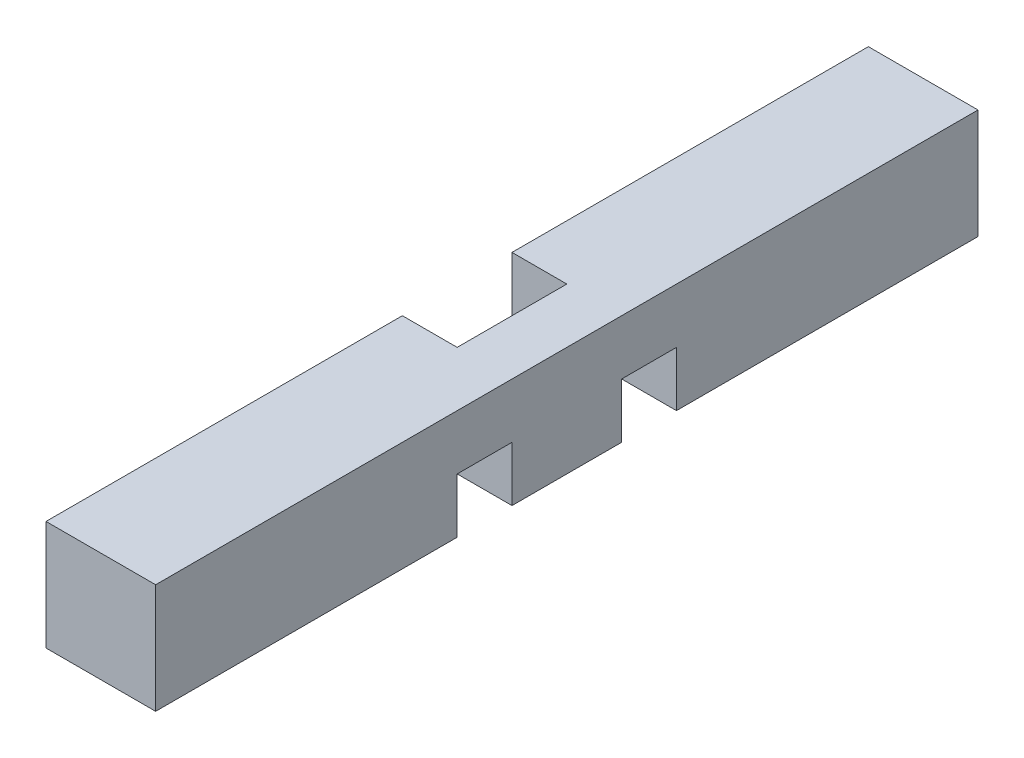
from build123d import *

# Parameters (mm, degrees)
SKETCH_1_W          = 4
SKETCH_1_H          = 4
EXTRUDE_1_DEPTH     = 30
SKETCH_3_W          = 8
SKETCH_3_H          = 2
CUT_EXTRUDE_1_DEPTH = 2
SKETCH_5_W          = 2
SKETCH_5_H          = 2
CUT_EXTRUDE_2_DEPTH = 2
SKETCH_6_W          = 2
SKETCH_6_H          = 2
CUT_EXTRUDE_3_DEPTH = 2
SKETCH_8_W          = 2
SKETCH_8_H          = 4
CUT_EXTRUDE_4_DEPTH = 2


with BuildPart() as part:
    # 草圖1 → 填料-伸長1 (new body)
    with BuildSketch(Plane.XY):
        Rectangle(SKETCH_1_W, SKETCH_1_H)
    extrude(amount=EXTRUDE_1_DEPTH)

    # 草圖3 → 除料-伸長1 (cut)
    with BuildSketch(Plane.ZY.offset(2)):
        with Locations((15, -1)):
            Rectangle(SKETCH_3_W, SKETCH_3_H)
    extrude(amount=-CUT_EXTRUDE_1_DEPTH, mode=Mode.SUBTRACT)

    # 草圖5 → 除料-伸長2 (cut)
    with BuildSketch(Plane.ZY):
        with Locations((18, -1)):
            Rectangle(SKETCH_5_W, SKETCH_5_H)
    extrude(amount=-CUT_EXTRUDE_2_DEPTH, mode=Mode.SUBTRACT)

    # 草圖6 → 除料-伸長3 (cut)
    with BuildSketch(Plane.ZY):
        with Locations((12, -1)):
            Rectangle(SKETCH_6_W, SKETCH_6_H)
    extrude(amount=-CUT_EXTRUDE_3_DEPTH, mode=Mode.SUBTRACT)

    # 草圖8 → 除料-伸長4 (cut)
    with BuildSketch(Plane.XZ):
        with Locations((-1, 15)):
            Rectangle(SKETCH_8_W, SKETCH_8_H)
    extrude(amount=-CUT_EXTRUDE_4_DEPTH, mode=Mode.SUBTRACT)


solid = part.part
